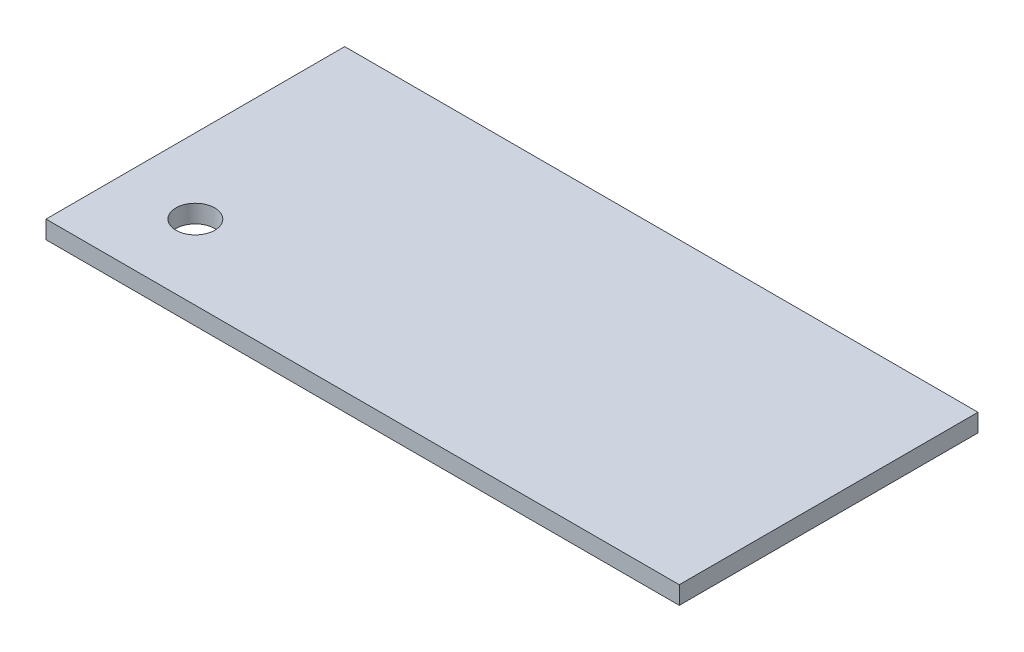
from build123d import *

# Parameters (mm, degrees)
SKETCH1_W           = 212
SKETCH1_H           = 100
BOSS_EXTRUDE1_DEPTH = 6
SKETCH2_R           = 6.5
CUT_EXTRUDE1_DEPTH  = 235.478143971


with BuildPart() as part:
    # Sketch1 → Boss-Extrude1 (new body)
    with BuildSketch(Plane(origin=(0, 0, 0), x_dir=(1, 0, 0), z_dir=(0, 1, 0))):
        with Locations((106, 50)):
            Rectangle(SKETCH1_W, SKETCH1_H)
    extrude(amount=BOSS_EXTRUDE1_DEPTH)

    # Sketch2 → Cut-Extrude1 (cut, through all)
    with BuildSketch(Plane(origin=(0, 6, 0), x_dir=(1, 0, 0), z_dir=(0, 1, 0))):
        with Locations(Location((25, 25, 0), (0, 0, 270))):
            Circle(SKETCH2_R)
    extrude(amount=-CUT_EXTRUDE1_DEPTH, mode=Mode.SUBTRACT)


solid = part.part
